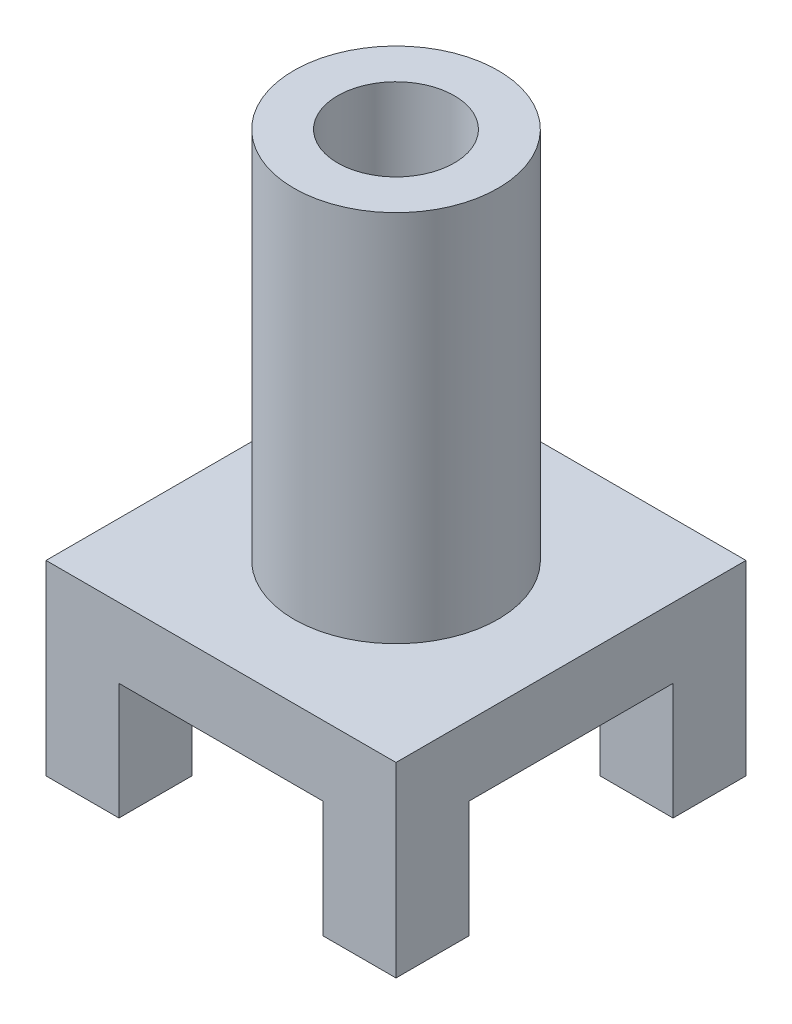
from build123d import *

# Parameters (mm, degrees)
CROQUIS1_W              = 60
CROQUIS1_H              = 60
SALIENTE_EXTRUIR2_DEPTH = 32
CROQUIS2_W              = 35
CROQUIS2_H              = 20
CORTAR_EXTRUIR1_DEPTH   = 75.323616704
CROQUIS4_W              = 35
CROQUIS4_H              = 20
CORTAR_EXTRUIR3_DEPTH   = 75.323616704
CROQUIS5_R              = 17.5
SALIENTE_EXTRUIR3_DEPTH = 64
CROQUIS6_R              = 10
CORTAR_EXTRUIR5_DEPTH   = 105.957134107


with BuildPart() as part:
    # Croquis1 → Saliente-Extruir2 (new body)
    with BuildSketch(Plane(origin=(0, 0, 0), x_dir=(1, 0, 0), z_dir=(0, 1, 0))):
        Rectangle(CROQUIS1_W, CROQUIS1_H)
    extrude(amount=SALIENTE_EXTRUIR2_DEPTH)

    # Croquis2 → Cortar-Extruir1 (cut, through all)
    with BuildSketch(Plane(origin=(30, 0, 0), x_dir=(0, 0, -1), z_dir=(1, 0, 0))):
        with Locations((0, 10)):
            Rectangle(CROQUIS2_W, CROQUIS2_H)
    extrude(amount=-CORTAR_EXTRUIR1_DEPTH, mode=Mode.SUBTRACT)

    # Croquis4 → Cortar-Extruir3 (cut, through all)
    with BuildSketch(Plane.XY.offset(30)):
        with Locations((0, 10)):
            Rectangle(CROQUIS4_W, CROQUIS4_H)
    extrude(amount=-CORTAR_EXTRUIR3_DEPTH, mode=Mode.SUBTRACT)

    # Croquis5 → Saliente-Extruir3 (add)
    with BuildSketch(Plane(origin=(0, 32, 0), x_dir=(1, 0, 0), z_dir=(0, 1, 0))):
        with Locations(Location((0, 0, 0), (0, 0, 270))):
            Circle(CROQUIS5_R)
    extrude(amount=SALIENTE_EXTRUIR3_DEPTH)

    # Croquis6 → Cortar-Extruir5 (cut, through all)
    with BuildSketch(Plane(origin=(0, 96, 0), x_dir=(1, 0, 0), z_dir=(0, 1, 0))):
        with Locations(Location((0, 0, 0), (0, 0, 270))):
            Circle(CROQUIS6_R)
    extrude(amount=-CORTAR_EXTRUIR5_DEPTH, mode=Mode.SUBTRACT)


solid = part.part
